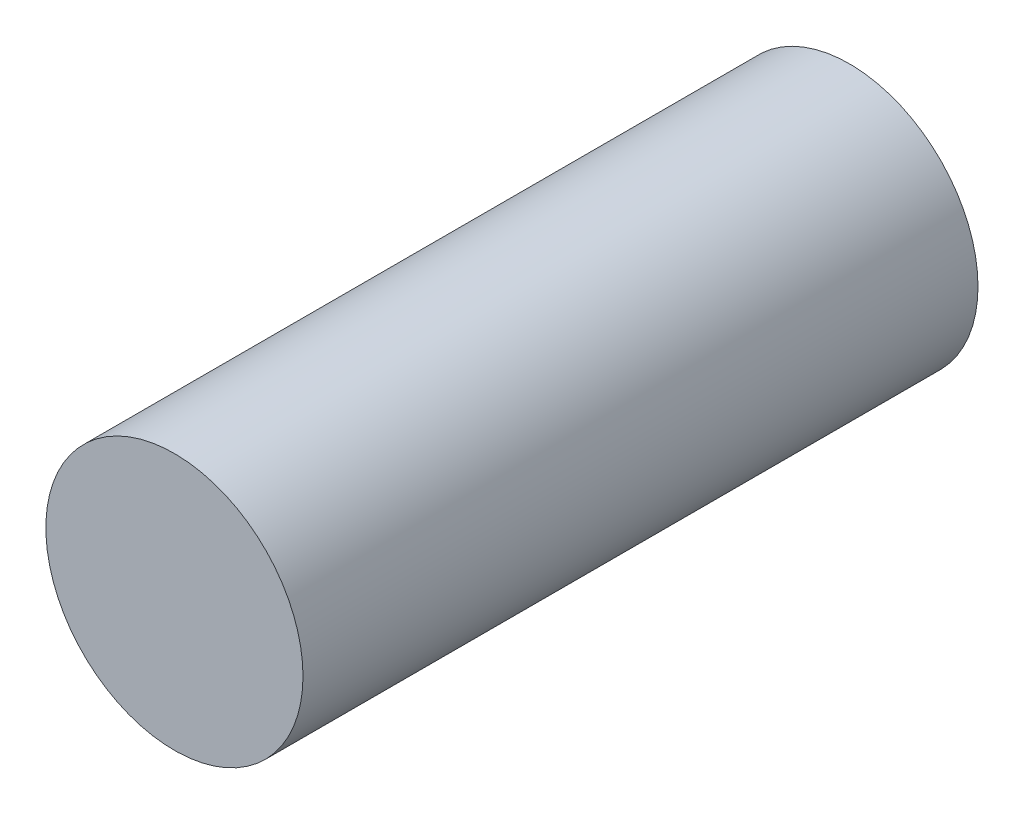
from build123d import *

# Parameters (mm, degrees)
SKETCH1_R           = 40
BOSS_EXTRUDE1_DEPTH = 210


with BuildPart() as part:
    # Sketch1 → Boss-Extrude1 (new body)
    with BuildSketch(Plane.XY):
        Circle(SKETCH1_R)
    extrude(amount=BOSS_EXTRUDE1_DEPTH)


solid = part.part
